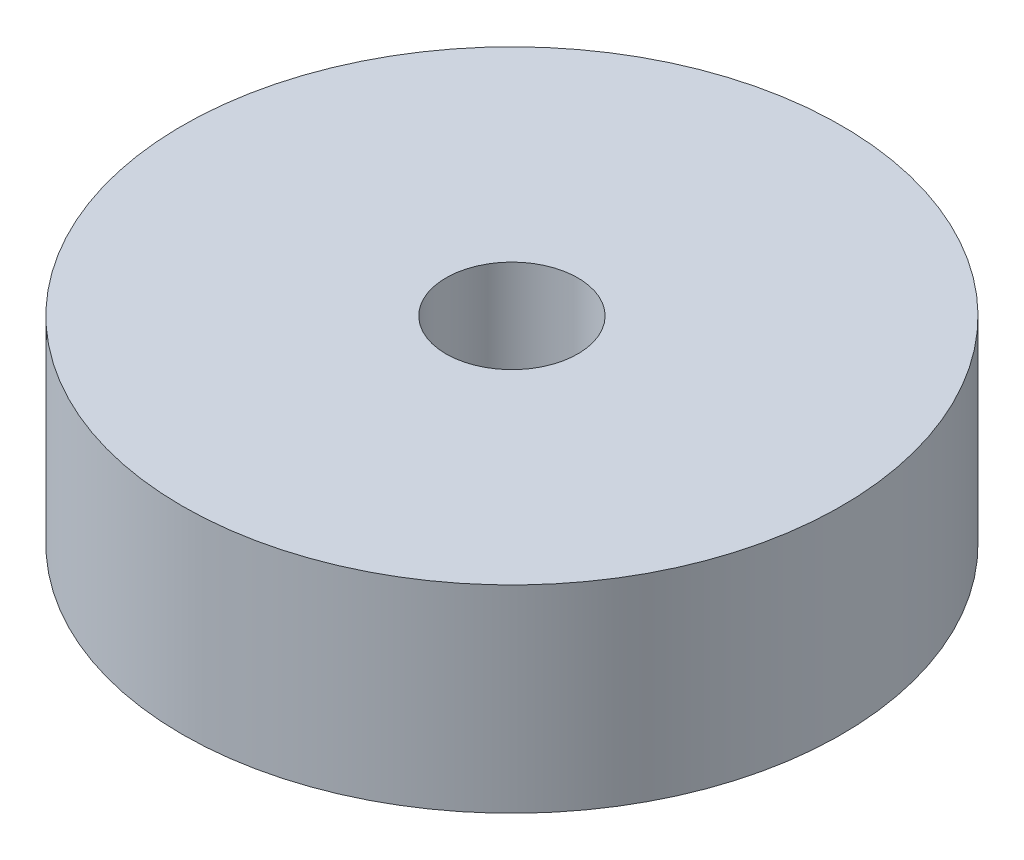
from build123d import *

# Parameters (mm, degrees)
SKETCH3_R           = 15
SKETCH3_R_2         = 3
BOSS_EXTRUDE1_DEPTH = 9


with BuildPart() as part:
    # Sketch3 → Boss-Extrude1 (new body)
    with BuildSketch(Plane(origin=(0, 0, 0), x_dir=(1, 0, 0), z_dir=(0, 1, 0))):
        with Locations(Location((0, 0, 0), (0, 0, 270))):
            Circle(SKETCH3_R)
        with Locations(Location((0, 0, 0), (0, 0, 270))):
            Circle(SKETCH3_R_2, mode=Mode.SUBTRACT)
    extrude(amount=BOSS_EXTRUDE1_DEPTH)


solid = part.part
